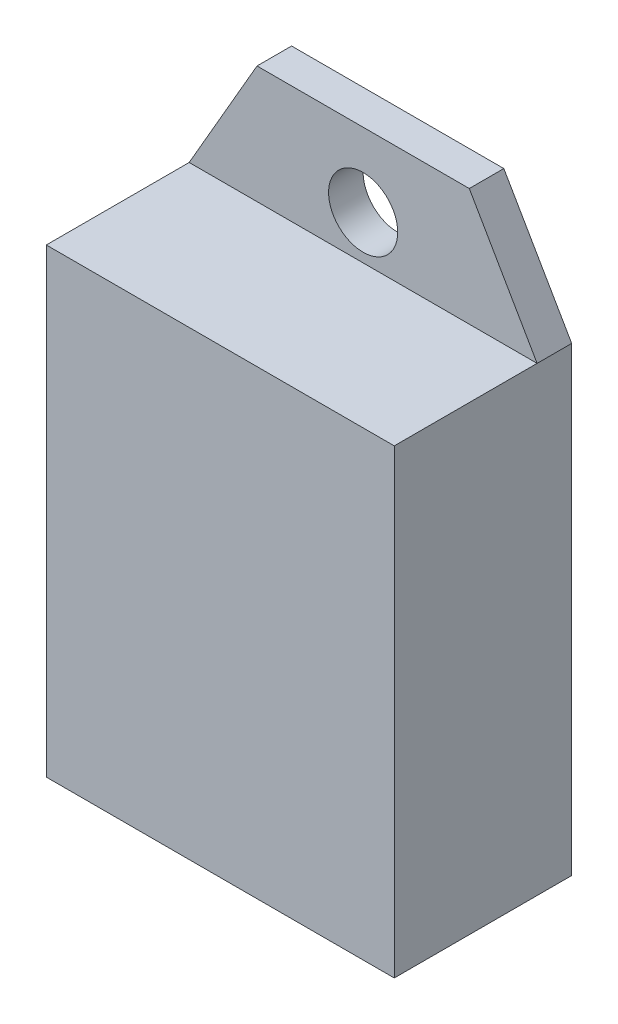
from build123d import *

# Parameters (mm, degrees)
SKETCH1_W           = 15.1
SKETCH1_H           = 20
BOSS_EXTRUDE1_DEPTH = 7.7
BOSS_EXTRUDE2_DEPTH = 1.5
SKETCH4_R           = 1.5
CUT_EXTRUDE1_DEPTH  = 18.984785236


with BuildPart() as part:
    # Sketch1 → Boss-Extrude1 (new body)
    with BuildSketch(Plane.XY):
        Rectangle(SKETCH1_W, SKETCH1_H)
    extrude(amount=BOSS_EXTRUDE1_DEPTH)

    # Sketch3 → Boss-Extrude2 (add)
    with BuildSketch(Plane(origin=(0, 0, 0), x_dir=(-1, 0, 0), z_dir=(0, 0, -1))):
        Polygon((4.605513627, 15.1), (-4.605513627, 15.1), (-7.55, 10), (7.55, 10), align=None)
    extrude(amount=-BOSS_EXTRUDE2_DEPTH)

    # Sketch4 → Cut-Extrude1 (cut, through all)
    with BuildSketch(Plane.XY.offset(1.5)):
        with Locations((0, 11.9)):
            Circle(SKETCH4_R)
    extrude(amount=-CUT_EXTRUDE1_DEPTH, mode=Mode.SUBTRACT)


solid = part.part
